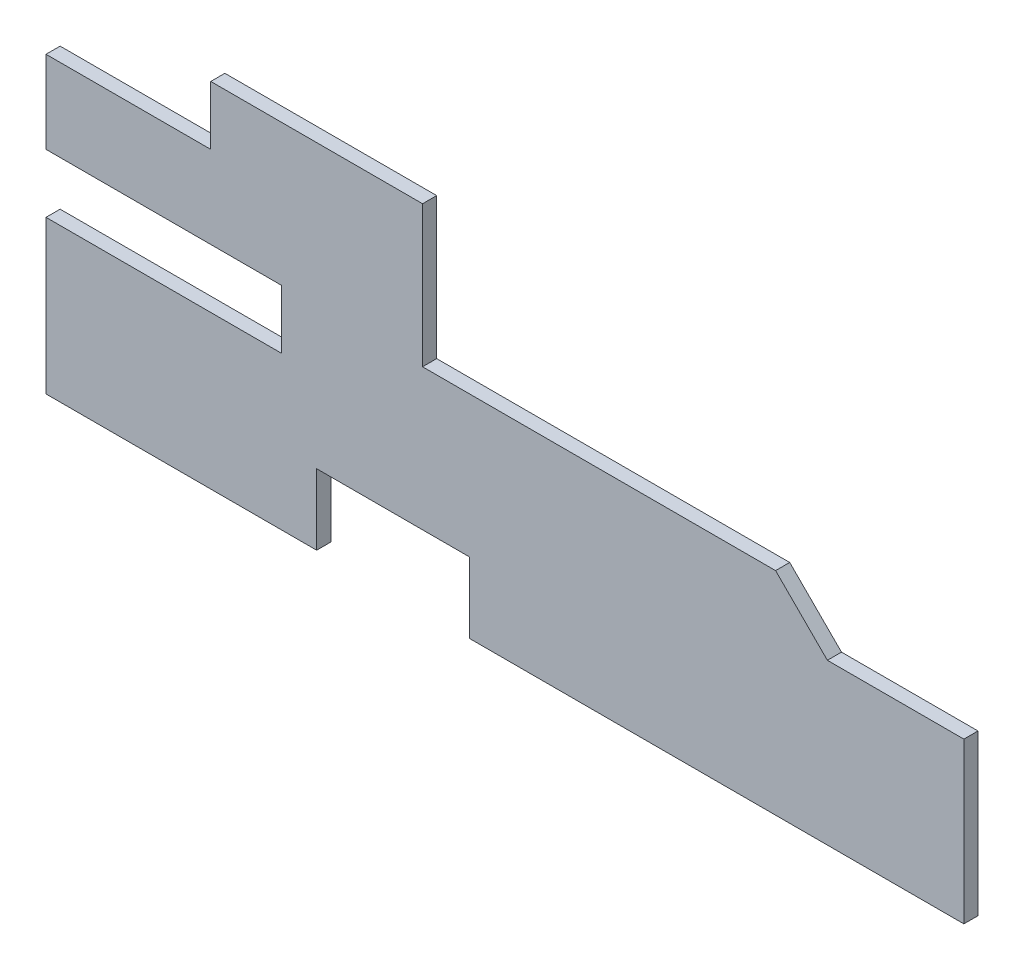
from build123d import *

# Parameters (mm, degrees)
EXTRUDE_1_DEPTH = 0.6


with BuildPart() as part:
    # 草图1 → 凸台-拉伸1 (new body)
    with BuildSketch(Plane.XY):
        Polygon((0, 0), (11.5, 0), (11.5, 3), (18, 3), (18, 0), (39, 0), (39, 6.8), (33.2, 6.8), (31, 9), (16, 9), (16, 15), (7, 15), (7, 12.5), (0, 12.5), (0, 9), (10, 9), (10, 6.5), (0, 6.5), align=None)
    extrude(amount=EXTRUDE_1_DEPTH)


solid = part.part
